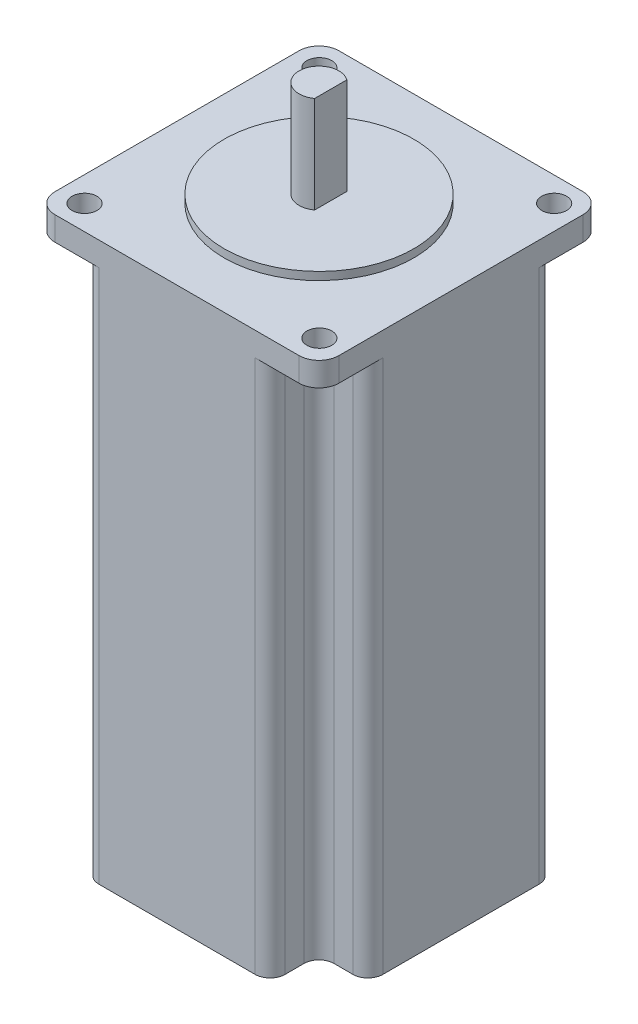
from build123d import *

# Parameters (mm, degrees)
BOSS_EXTRUDE1_DEPTH  = 112
SKETCH2_R            = 19.05
BOSS_EXTRUDE2_DEPTH  = 1.6
SKETCH3_R            = 4
BOSS_EXTRUDE3_DEPTH  = 19.4
SKETCH4_W            = 7.896046337
SKETCH4_H            = 7.324948646
CUT_EXTRUDE1_DEPTH   = 19.4
CUT_EXTRUDE2_DEPTH   = 107.2
MIRROR2_COPY_1_DEPTH = 107.2
FILLET1_R            = 3
SKETCH6_R            = 2.5
CUT_EXTRUDE3_DEPTH   = 107.2


with BuildPart() as part:
    # Sketch1 → Boss-Extrude1 (new body)
    with BuildSketch(Plane(origin=(0, 0, 0), x_dir=(1, 0, 0), z_dir=(0, 1, 0))):
        with BuildLine():
            Line((-24.5, -28.5), (24.5, -28.5))
            ThreePointArc((24.5, -28.5), (27.328427125, -27.328427125), (28.5, -24.5))
            Line((28.5, -24.5), (28.5, 24.5))
            ThreePointArc((28.5, 24.5), (27.328427125, 27.328427125), (24.5, 28.5))
            Line((24.5, 28.5), (-24.5, 28.5))
            ThreePointArc((-24.5, 28.5), (-27.328427125, 27.328427125), (-28.5, 24.5))
            Line((-28.5, 24.5), (-28.5, -24.5))
            ThreePointArc((-28.5, -24.5), (-27.328427125, -27.328427125), (-24.5, -28.5))
        make_face()
    extrude(amount=BOSS_EXTRUDE1_DEPTH)

    # Sketch2 → Boss-Extrude2 (add)
    with BuildSketch(Plane(origin=(0, 112, 0), x_dir=(1, 0, 0), z_dir=(0, 1, 0))):
        with Locations(Location((0, 0, 0), (0, 0, 270))):
            Circle(SKETCH2_R)
    extrude(amount=BOSS_EXTRUDE2_DEPTH)

    # Sketch3 → Boss-Extrude3 (add)
    with BuildSketch(Plane(origin=(0, 113.6, 0), x_dir=(1, 0, 0), z_dir=(0, 1, 0))):
        with Locations(Location((0, 0, 0), (0, 0, 270))):
            Circle(SKETCH3_R)
    extrude(amount=BOSS_EXTRUDE3_DEPTH)

    # Sketch4 → Cut-Extrude1 (cut)
    with BuildSketch(Plane(origin=(0, 133, 0), x_dir=(1, 0, 0), z_dir=(0, 1, 0))):
        with Locations((6.304367274, 0.076945889)):
            Rectangle(SKETCH4_W, SKETCH4_H)
    extrude(amount=-CUT_EXTRUDE1_DEPTH, mode=Mode.SUBTRACT)

    # Sketch5 → Cut-Extrude2 (cut)
    with BuildSketch(Plane.XZ):
        with BuildLine():
            Line((-28.5, 24.5), (-28.5, 18.683107864))
            Line((-28.5, 18.683107864), (-18.683107864, 18.683107864))
            Line((-18.683107864, 18.683107864), (-18.683107864, 28.5))
            Line((-18.683107864, 28.5), (-24.5, 28.5))
            ThreePointArc((-24.5, 28.5), (-27.328427125, 27.328427125), (-28.5, 24.5))
        make_face()
    cut_extrude2 = extrude(amount=-CUT_EXTRUDE2_DEPTH, mode=Mode.SUBTRACT)

    # Mirror1: Cut-Extrude2 across plane
    add(cut_extrude2.mirror(Plane(origin=(0, 0, 0), x_dir=(0, 0, 1), z_dir=(1, 0, 0))), mode=Mode.SUBTRACT)

    # Mirror2: Cut-Extrude2 across plane
    add(cut_extrude2.mirror(Plane.XY), mode=Mode.SUBTRACT)

    # Mirror2 copy 1 sketch → Mirror2 copy 1 (cut)
    with BuildSketch(Plane(origin=(0, 0, 0), x_dir=(-1, 0, 0), z_dir=(0, -1, 0))):
        with BuildLine():
            Line((-28.5, 24.5), (-28.5, 18.683107864))
            Line((-28.5, 18.683107864), (-18.683107864, 18.683107864))
            Line((-18.683107864, 18.683107864), (-18.683107864, 28.5))
            Line((-18.683107864, 28.5), (-24.5, 28.5))
            ThreePointArc((-24.5, 28.5), (-27.328427125, 27.328427125), (-28.5, 24.5))
        make_face()
    extrude(amount=-MIRROR2_COPY_1_DEPTH, mode=Mode.SUBTRACT)

    # Fillet1
    fillet1_edges = [part.edges().sort_by_distance(p)[0] for p in [
        (-18.683107864, 53.6, -18.683107864),
        (-18.683107864, 53.6, -28.5),
        (-28.5, 53.6, -18.683107864),
        (-18.683107864, 53.6, 28.5),
        (-18.683107864, 53.6, 18.683107864),
        (-28.5, 53.6, 18.683107864),
        (18.683107864, 53.6, 18.683107864),
        (18.683107864, 53.6, 28.5),
        (28.5, 53.6, 18.683107864),
        (18.683107864, 53.6, -28.5),
        (18.683107864, 53.6, -18.683107864),
        (28.5, 53.6, -18.683107864),
    ]]
    fillet(fillet1_edges, radius=FILLET1_R)

    # Sketch6 → Cut-Extrude3 (cut)
    with BuildSketch(Plane(origin=(0, 112, 0), x_dir=(1, 0, 0), z_dir=(0, 1, 0))):
        with Locations(Location((23.64, 23.57, 0), (0, 0, 270))):
            Circle(SKETCH6_R)
        with Locations(Location((23.5, -23.429791489, 0), (0, 0, 270))):
            Circle(SKETCH6_R)
        with Locations(Location((-23.5, 23.57, 0), (0, 0, 270))):
            Circle(SKETCH6_R)
        with Locations(Location((-23.5, -23.57, 0), (0, 0, 270))):
            Circle(SKETCH6_R)
    extrude(amount=-CUT_EXTRUDE3_DEPTH, mode=Mode.SUBTRACT)


solid = part.part
